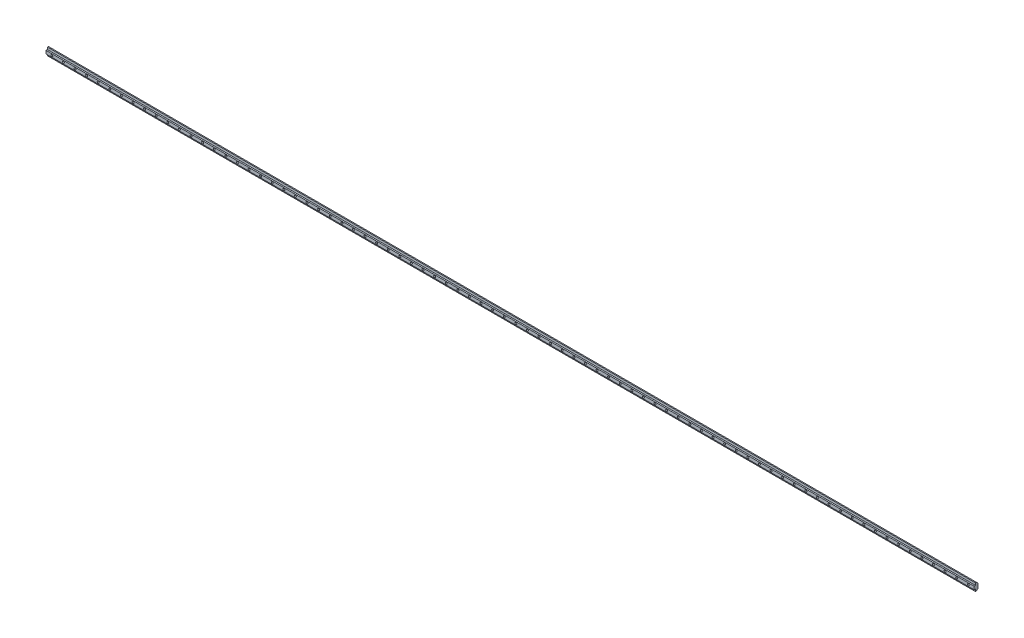
from build123d import *

# Parameters (mm, degrees)
SKETCH_1_W             = 2400
SKETCH_1_H             = 19.6
EXTRUDE_1_DEPTH        = 6.6
SKETCH_2_W             = 2400
SKETCH_2_H             = 8.1
EXTRUDE_2_DEPTH        = 3.5
CHAMFER_1_SIZE         = 4
HOLE_WIZARD_M6_1_D     = 5
PATTERN_LINEAR_1_COUNT = 80
PATTERN_LINEAR_1_PITCH = 30


with BuildPart() as part:
    # 草图1 → 凸台-拉伸1 (new body)
    with BuildSketch(Plane.XY):
        Rectangle(SKETCH_1_W, SKETCH_1_H)
    extrude(amount=EXTRUDE_1_DEPTH)

    # 草图2 → 凸台-拉伸2 (add)
    with BuildSketch(Plane.XY.offset(6.6)):
        Rectangle(SKETCH_2_W, SKETCH_2_H)
    extrude(amount=EXTRUDE_2_DEPTH)

    # 倒角1
    chamfer_1_edges = [part.edges().sort_by_distance(p)[0] for p in [
        (0, -9.8, 0),
        (0, 9.8, 0),
    ]]
    chamfer(chamfer_1_edges, length=CHAMFER_1_SIZE)

    # M6 螺纹孔1 (through all)
    with Locations(Plane.XY.offset(10.1)):
        with Locations((-1185, 0)):
            hole_wizard_m6_1 = Hole(HOLE_WIZARD_M6_1_D / 2)

    # 阵列(线性)1: M6 螺纹孔1 ×80
    with Locations(*[(i * PATTERN_LINEAR_1_PITCH, 0, 0) for i in range(1, PATTERN_LINEAR_1_COUNT)]):
        add(hole_wizard_m6_1, mode=Mode.SUBTRACT)


solid = part.part
